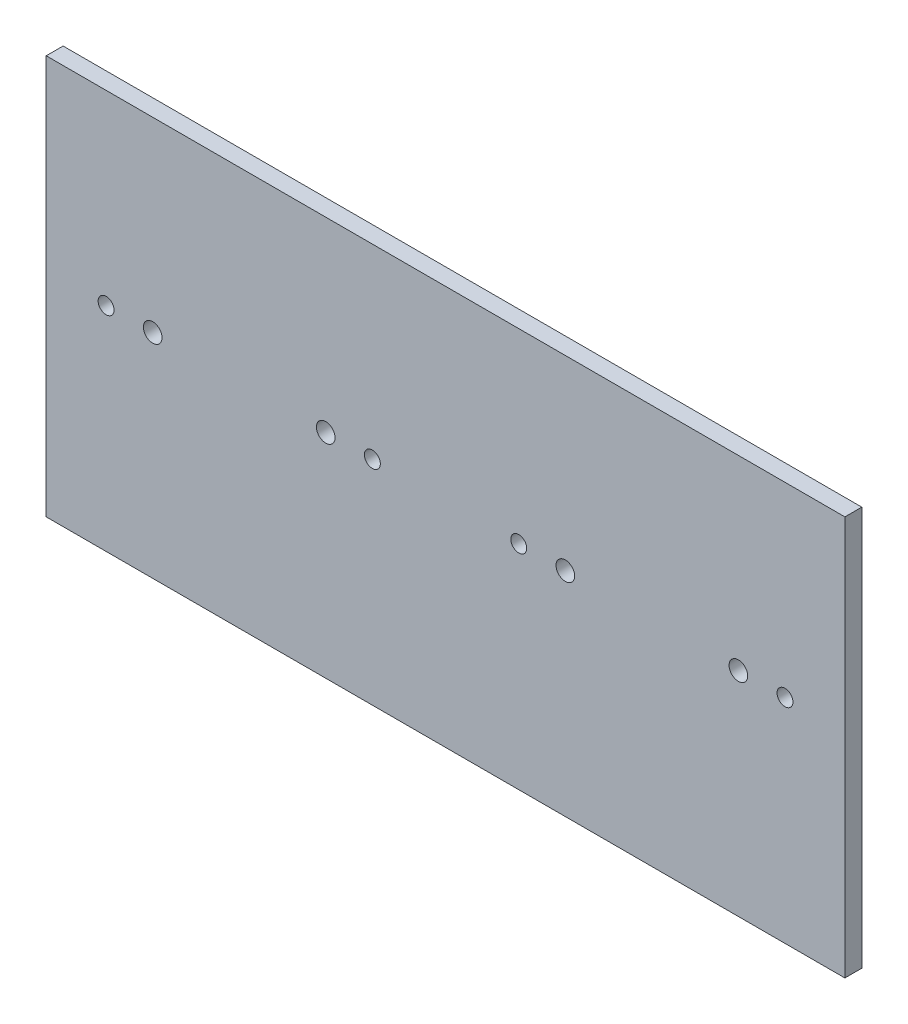
from build123d import *

# Parameters (mm, degrees)
SKETCH1_W           = 300
SKETCH1_H           = 150
SKETCH1_R           = 2.995
SKETCH1_R_2         = 3.5
BOSS_EXTRUDE1_DEPTH = 6.35


with BuildPart() as part:
    # Sketch1 → Boss-Extrude1 (new body)
    with BuildSketch(Plane.XY):
        with Locations((150, 75)):
            Rectangle(SKETCH1_W, SKETCH1_H)
        with Locations((22.5, 80)):
            Circle(SKETCH1_R, mode=Mode.SUBTRACT)
        with Locations((122.5, 80)):
            Circle(SKETCH1_R, mode=Mode.SUBTRACT)
        with Locations((277.5, 80)):
            Circle(SKETCH1_R, mode=Mode.SUBTRACT)
        with Locations((177.5, 80)):
            Circle(SKETCH1_R, mode=Mode.SUBTRACT)
        with Locations((40, 80)):
            Circle(SKETCH1_R_2, mode=Mode.SUBTRACT)
        with Locations((105, 80)):
            Circle(SKETCH1_R_2, mode=Mode.SUBTRACT)
        with Locations((195, 80)):
            Circle(SKETCH1_R_2, mode=Mode.SUBTRACT)
        with Locations((260, 80)):
            Circle(SKETCH1_R_2, mode=Mode.SUBTRACT)
    extrude(amount=BOSS_EXTRUDE1_DEPTH)


solid = part.part
